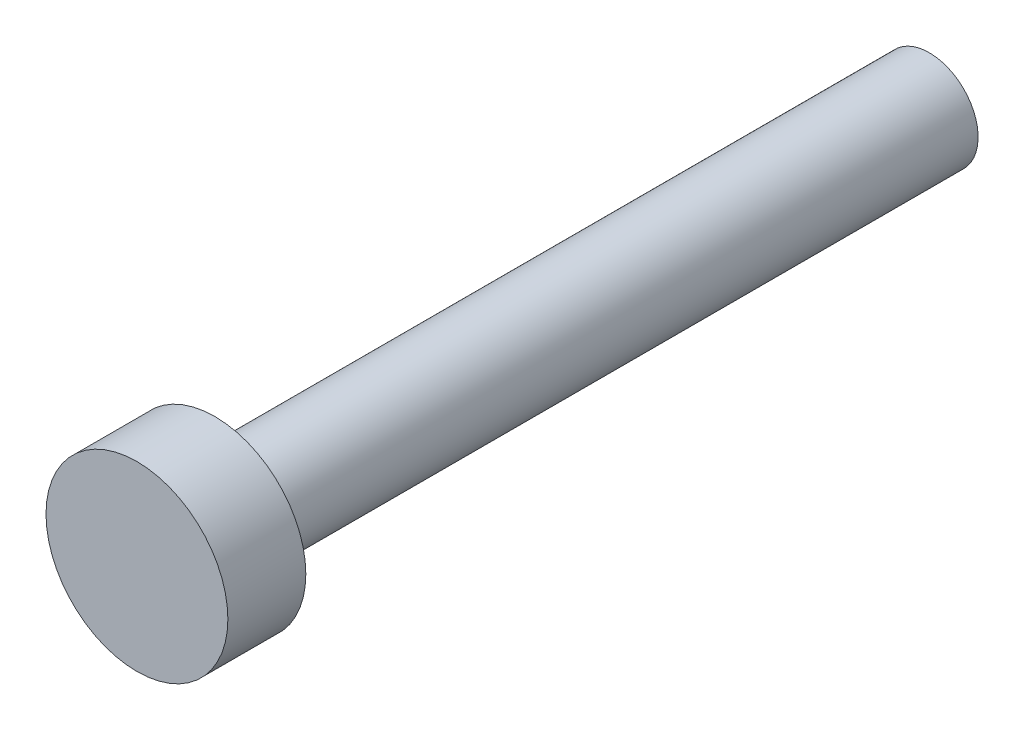
from build123d import *

# Parameters (mm, degrees)
ESQUISSE1_R        = 2.8
BOSS_EXTRU_1_DEPTH = 2.4
ESQUISSE2_R        = 1.5
BOSS_EXTRU_2_DEPTH = 22


with BuildPart() as part:
    # Esquisse1 → Boss.-Extru.1 (new body)
    with BuildSketch(Plane.XY):
        Circle(ESQUISSE1_R)
    extrude(amount=BOSS_EXTRU_1_DEPTH)

    # Esquisse2 → Boss.-Extru.2 (add)
    with BuildSketch(Plane(origin=(0, 0, 0), x_dir=(-1, 0, 0), z_dir=(0, 0, -1))):
        Circle(ESQUISSE2_R)
    extrude(amount=BOSS_EXTRU_2_DEPTH)


solid = part.part
